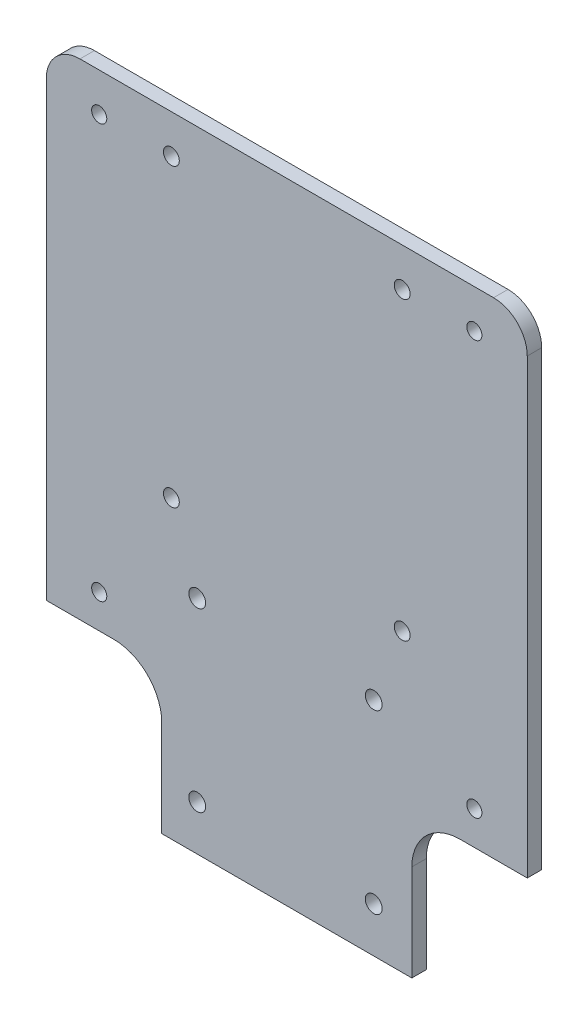
from build123d import *

# Parameters (mm, degrees)
SKETCH2_R           = 1.575
SKETCH2_R_2         = 1.75
BOSS_EXTRUDE1_DEPTH = 3
SKETCH3_R           = 1.65
CUT_EXTRUDE1_DEPTH  = 10
FILLET1_R           = 10


with BuildPart() as part:
    # Sketch2 → Boss-Extrude1 (new body)
    with BuildSketch(Plane.XY.offset(27)):
        with BuildLine():
            Line((50, 113.943914812), (50, 149))
            ThreePointArc((50, 149), (47.949747468, 153.949747468), (43, 156))
            Line((43, 156), (-43, 156))
            ThreePointArc((-43, 156), (-47.949747468, 153.949747468), (-50, 149))
            Line((-50, 149), (-50, 113.943914812))
            Line((-50, 113.943914812), (-50, 55))
            Line((-50, 55), (-26, 55))
            Line((-26, 55), (-26, 25))
            Line((-26, 25), (26, 25))
            Line((26, 25), (26, 55))
            Line((26, 55), (50, 55))
            Line((50, 55), (50, 113.943914812))
        make_face()
        with Locations((39, 62)):
            Circle(SKETCH2_R, mode=Mode.SUBTRACT)
        with Locations((-39, 62)):
            Circle(SKETCH2_R, mode=Mode.SUBTRACT)
        with Locations((39, 148)):
            Circle(SKETCH2_R, mode=Mode.SUBTRACT)
        with Locations((-39, 148)):
            Circle(SKETCH2_R, mode=Mode.SUBTRACT)
        with Locations((-18.621445193, 71.094788901)):
            Circle(SKETCH2_R_2, mode=Mode.SUBTRACT)
        with Locations((18.078554807, 71.094788901)):
            Circle(SKETCH2_R_2, mode=Mode.SUBTRACT)
        with Locations((-18.621445193, 34.394788901)):
            Circle(SKETCH2_R_2, mode=Mode.SUBTRACT)
        with Locations((18.078554807, 34.394788901)):
            Circle(SKETCH2_R_2, mode=Mode.SUBTRACT)
    extrude(amount=BOSS_EXTRUDE1_DEPTH)

    # Sketch3 → Cut-Extrude1 (cut)
    with BuildSketch(Plane.XY.offset(30)):
        with Locations((-24, 147.978654182)):
            Circle(SKETCH3_R)
        with Locations((24, 86.478654182)):
            Circle(SKETCH3_R)
        with Locations((-24, 86.478654182)):
            Circle(SKETCH3_R)
        with Locations((24, 147.978654182)):
            Circle(SKETCH3_R)
    extrude(amount=-CUT_EXTRUDE1_DEPTH, mode=Mode.SUBTRACT)

    # Fillet1
    fillet1_edges = [part.edges().sort_by_distance(p)[0] for p in [
        (26, 55, 28.5),
        (-26, 55, 28.5),
    ]]
    fillet(fillet1_edges, radius=FILLET1_R)


solid = part.part
